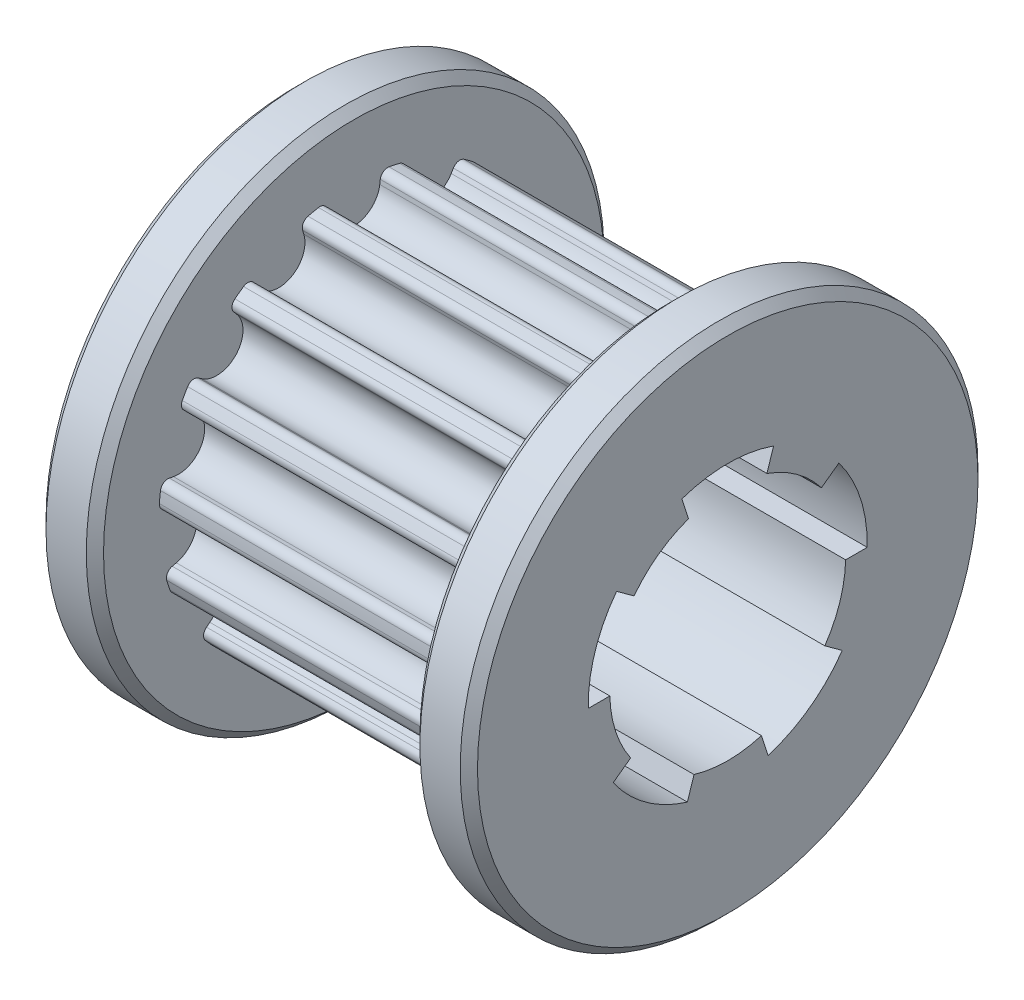
from build123d import *
from build123d.topology import SkipClean

# Parameters (mm, degrees)
CHAMFER_1_SIZE           = 1
SKETCH_4_W               = 2
SKETCH_4_H               = 1.440270842
CUT_EXTRUDE_1_DEPTH      = 23.179036994
CUT_EXTRUDE_2_REACH      = 24.179
PATTERN_CIRCULAR_3_COUNT = 15
SKETCH_7_R               = 3
CUT_EXTRUDE_3_DEPTH      = 23.173117564
EXTRUDE_START            = 2
SKETCH_9_R               = 9
SKETCH_9_R_2             = 3
EXTRUDE_1_DEPTH          = 2
SKETCH_10_R              = 9
SKETCH_10_R_2            = 3
EXTRUDE_2_DEPTH          = 2
CHAMFER_2_SIZE           = 0.3
SKETCH_11_R              = 4
CUT_EXTRUDE_4_DEPTH      = 20.672315573
CUT_EXTRUDE_5_DEPTH      = 20.672315573
PATTERN_CIRCULAR_4_COUNT = 5
CUT_EXTRUDE_6_DEPTH      = 20.672315573


with BuildPart() as part:
    # 草图1 → 旋转1 (revolve)
    with BuildSketch(Plane.XY):
        Polygon((0, 1.3558), (0, 6.779), (11, 6.779), (11, 2.7116), (20, 2.7116), (20, 1.3558), align=None)
    revolve(axis=Axis((0, 0, 0), (1, 0, 0)))

    # 倒角1
    chamfer_1_edges = [part.edges().sort_by_distance(p)[0] for p in [
        (20, -1.3558, 0),
        (0, -1.3558, 0),
    ]]
    chamfer(chamfer_1_edges, length=CHAMFER_1_SIZE)

    # 草图4 → 切除-拉伸1 (cut, through all)
    with BuildSketch(Plane.ZY):
        with Locations((0, 1.635664579)):
            Rectangle(SKETCH_4_W, SKETCH_4_H)
    extrude(amount=-CUT_EXTRUDE_1_DEPTH, mode=Mode.SUBTRACT)

    # 草图6 → 切除-拉伸2 (cut, up to next)
    with BuildSketch(Plane(origin=(0, 0, 0), x_dir=(0, 0, -1), z_dir=(1, 0, 0)), mode=Mode.PRIVATE) as cut_extrude_2_sk1:
        with BuildLine():
            Line((0.921029279, 6.443168288), (0.903216998, 6.298098898))
            ThreePointArc((0.903216998, 6.298098898), (0, 5.499), (-0.903216998, 6.298098898))
            Line((-0.903216998, 6.298098898), (-0.921029279, 6.443168288))
            ThreePointArc((-0.921029279, 6.443168288), (-1.025205225, 6.62105106), (-1.226117469, 6.667194084))
            ThreePointArc((-1.226117469, 6.667194084), (-1.353747907, 6.642454938), (-1.480880455, 6.615272789))
            Line((-1.480880455, 6.615272789), (-1.677528444, 8.216842132))
            ThreePointArc((-1.677528444, 8.216842132), (0, 8.386333901), (1.677528444, 8.216842132))
            Line((1.677528444, 8.216842132), (1.480880455, 6.615272789))
            ThreePointArc((1.480880455, 6.615272789), (1.353747907, 6.642454938), (1.226117469, 6.667194084))
            ThreePointArc((1.226117469, 6.667194084), (1.025205225, 6.62105106), (0.921029279, 6.443168288))
        make_face()
    cut_extrude_2_tool1 = extrude(cut_extrude_2_sk1.sketch, amount=CUT_EXTRUDE_2_REACH, mode=Mode.PRIVATE) & part.part
    cut_extrude_2 = cut_extrude_2_tool1.solids().sort_by_distance((0, 7.172733, 0))[0]
    add(cut_extrude_2, mode=Mode.SUBTRACT)

    # 阵列(圆周)3: 切除-拉伸2 ×15 about axis
    pattern_circular_3_axis = Axis((-2.75, 0, 0), (1, 0, 0))
    for i in range(1, PATTERN_CIRCULAR_3_COUNT):
        add(cut_extrude_2.rotate(pattern_circular_3_axis, i * 360 / PATTERN_CIRCULAR_3_COUNT), mode=Mode.SUBTRACT)

    # 草图7 → 切除-拉伸3 (cut, through all)
    with BuildSketch(Plane.ZY):
        Circle(SKETCH_7_R)
    extrude(amount=-CUT_EXTRUDE_3_DEPTH, mode=Mode.SUBTRACT)

    # 草图9 → 凸台-拉伸1 (add)
    with BuildSketch(Plane.ZY.offset(EXTRUDE_START)):
        Circle(SKETCH_9_R)
        Circle(SKETCH_9_R_2, mode=Mode.SUBTRACT)
    extrude(amount=-EXTRUDE_1_DEPTH)

    # 草图10 → 凸台-拉伸2 (add)
    with SkipClean():  # the faces are left unmerged after this step: merging them gives an invalid solid
        with BuildSketch(Plane(origin=(11, 0, 0), x_dir=(0, 0, -1), z_dir=(1, 0, 0))):
            Circle(SKETCH_10_R)
            Circle(SKETCH_10_R_2, mode=Mode.SUBTRACT)
        extrude(amount=EXTRUDE_2_DEPTH)

    # 倒角2
    chamfer_2_edges = [part.edges().sort_by_distance(p)[0] for p in [
        (13, 0, 9),
        (11, 0, 9),
        (0, 0, -9),
        (-2, 0, -9),
    ]]
    chamfer(chamfer_2_edges, length=CHAMFER_2_SIZE)

    # 草图11 → 切除-拉伸4 (cut, through all)
    with BuildSketch(Plane.ZY.offset(2)):
        Circle(SKETCH_11_R)
    extrude(amount=-CUT_EXTRUDE_4_DEPTH, mode=Mode.SUBTRACT)

    # 草图12 → 切除-拉伸5 (cut, through all)
    with BuildSketch(Plane.ZY.offset(2)):
        with BuildLine():
            Line((-1.467830723, 4.517518452), (-1.236067977, 3.804226065))
            ThreePointArc((-1.236067977, 3.804226065), (0, 4), (1.236067977, 3.804226065))
            Line((1.236067977, 3.804226065), (1.467830723, 4.517518452))
            ThreePointArc((1.467830723, 4.517518452), (0, 4.75), (-1.467830723, 4.517518452))
        make_face()
    cut_extrude_5 = extrude(amount=-CUT_EXTRUDE_5_DEPTH, mode=Mode.SUBTRACT)

    # 阵列(圆周)4: 切除-拉伸5 ×5 about axis
    pattern_circular_4_axis = Axis((-2, 0, 0), (-1, 0, 0))
    for i in range(1, PATTERN_CIRCULAR_4_COUNT):
        add(cut_extrude_5.rotate(pattern_circular_4_axis, i * 360 / PATTERN_CIRCULAR_4_COUNT), mode=Mode.SUBTRACT)

    # 草图13 → 切除-拉伸6 (cut, through all)
    with BuildSketch(Plane.ZY.offset(2)):
        with BuildLine():
            Line((-1.593519466, 4.58074183), (-1.361698423, 3.86727002))
            ThreePointArc((-1.361698423, 3.86727002), (-2.409919534, 3.316969677), (-3.257204399, 2.490104316))
            Line((-3.257204399, 2.490104316), (-3.864119771, 2.931054144))
            ThreePointArc((-3.864119771, 2.931054144), (-4.612624104, 1.498732423), (-4.848968963, -0.1))
            Line((-4.848968963, -0.1), (-4.098780306, -0.1))
            ThreePointArc((-4.098780306, -0.1), (-3.899331717, -1.266969677), (-3.374761449, -2.328300917))
            Line((-3.374761449, -2.328300917), (-3.981676821, -2.769250746))
            ThreePointArc((-3.981676821, -2.769250746), (-2.850758474, -3.923732423), (-1.403308163, -4.642545229))
            Line((-1.403308163, -4.642545229), (-1.171487119, -3.929073419))
            ThreePointArc((-1.171487119, -3.929073419), (0, -4.1), (1.171487119, -3.929073419))
            Line((1.171487119, -3.929073419), (1.403308163, -4.642545229))
            ThreePointArc((1.403308163, -4.642545229), (2.850758474, -3.923732423), (3.981676821, -2.769250746))
            Line((3.981676821, -2.769250746), (3.374761449, -2.328300917))
            ThreePointArc((3.374761449, -2.328300917), (3.899331717, -1.266969677), (4.098780306, -0.1))
            Line((4.098780306, -0.1), (4.848968963, -0.1))
            ThreePointArc((4.848968963, -0.1), (4.612624104, 1.498732423), (3.864119771, 2.931054144))
            Line((3.864119771, 2.931054144), (3.257204399, 2.490104316))
            ThreePointArc((3.257204399, 2.490104316), (2.409919534, 3.316969677), (1.361698423, 3.86727002))
            Line((1.361698423, 3.86727002), (1.593519466, 4.58074183))
            ThreePointArc((1.593519466, 4.58074183), (0, 4.85), (-1.593519466, 4.58074183))
        make_face()
    extrude(amount=-CUT_EXTRUDE_6_DEPTH, mode=Mode.SUBTRACT)


solid = part.part
